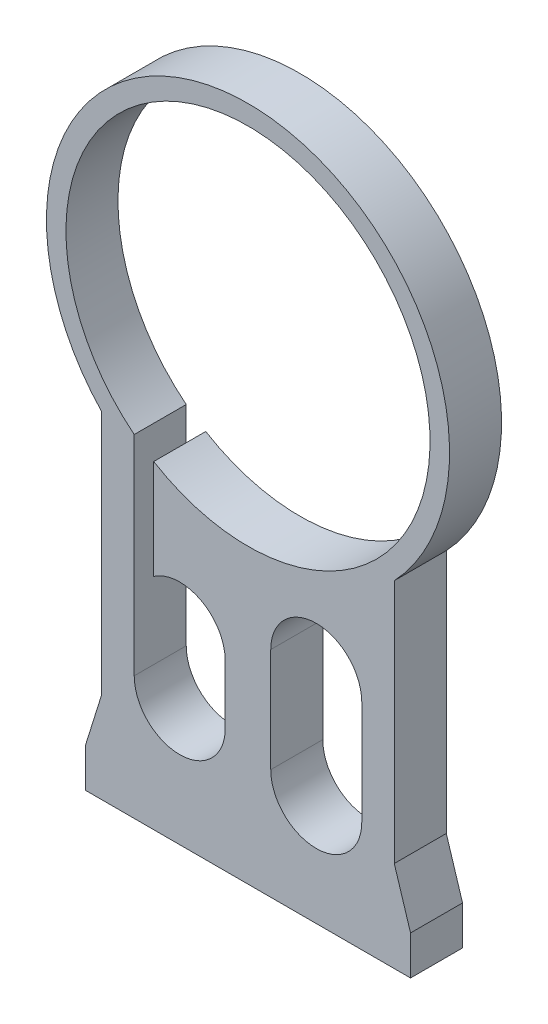
from build123d import *

# Parameters (mm, degrees)
DODANIE_WYCI_GNI_CIE1_DEPTH = 4


with BuildPart() as part:
    # Szkic1 → Dodanie-wyciągnięcie1 (new body)
    with BuildSketch(Plane.XY):
        with BuildLine():
            Line((12.5, 0), (-12.5, 0))
            Line((-12.5, 0), (-12.5, 3))
            Line((-12.5, 3), (-11.25, 7))
            Line((-11.25, 7), (-11.25, 25.837565944))
            ThreePointArc((-11.25, 25.837565944), (0, 52), (11.25, 25.837565944))
            Line((11.25, 25.837565944), (11.25, 7))
            Line((11.25, 7), (12.5, 3))
            Line((12.5, 3), (12.5, 0))
        make_face()
        with BuildLine():
            Line((8.75, 16.5), (8.75, 8.5))
            ThreePointArc((8.75, 8.5), (5.25, 5), (1.75, 8.5))
            Line((1.75, 8.5), (1.75, 16.5))
            ThreePointArc((1.75, 16.5), (5.25, 20), (8.75, 16.5))
        make_face(mode=Mode.SUBTRACT)
        with BuildLine():
            Line((-1.75, 14), (-1.75, 9.5))
            ThreePointArc((-1.75, 9.5), (-5.25, 6), (-8.75, 9.5))
            Line((-8.75, 9.5), (-8.75, 14))
            Line((-8.75, 14), (-8.75, 25.571253503))
            ThreePointArc((-8.75, 25.571253503), (8.017135871, 47.977174409), (-7.25, 24.523460433))
            Line((-7.25, 24.523460433), (-7.25, 16.872281323))
            ThreePointArc((-7.25, 16.872281323), (-3.629814825, 17.102418411), (-1.75, 14))
        make_face(mode=Mode.SUBTRACT)
    extrude(amount=DODANIE_WYCI_GNI_CIE1_DEPTH)


solid = part.part
